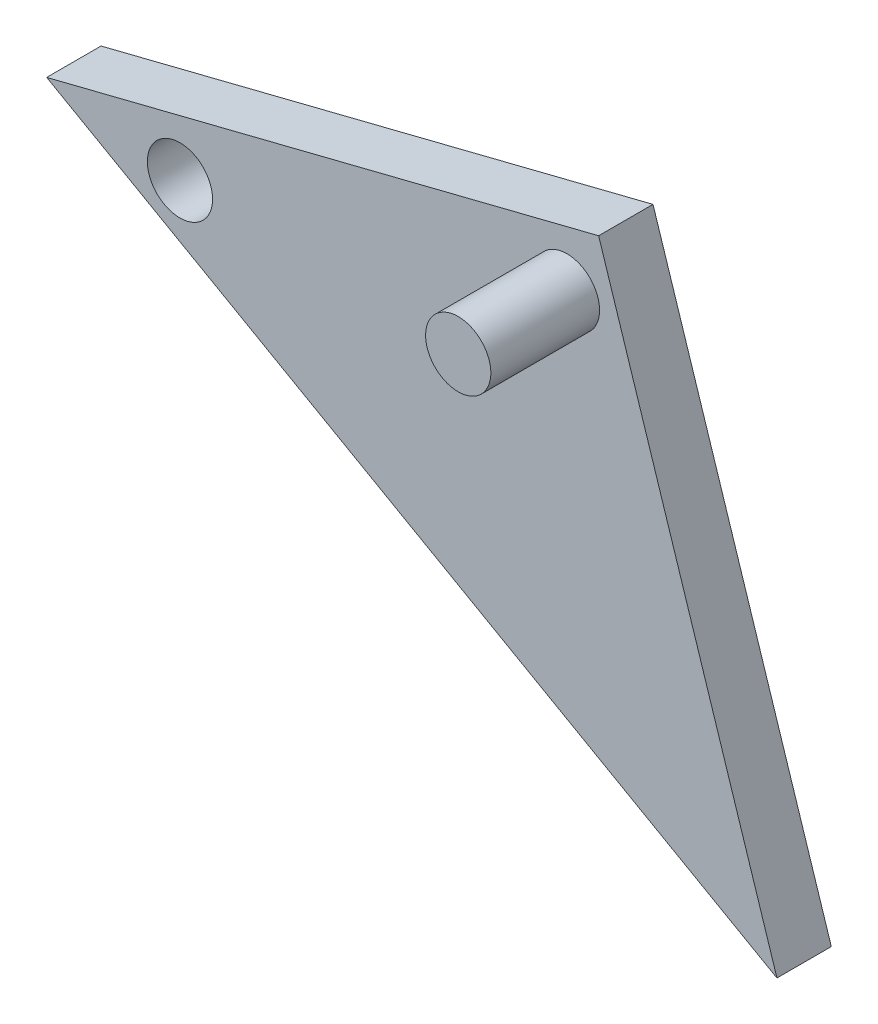
from build123d import *

# Parameters (mm, degrees)
SKETCH1_R           = 3
BOSS_EXTRUDE1_DEPTH = 5
SKETCH2_R           = 3
BOSS_EXTRUDE2_DEPTH = 15


with BuildPart() as part:
    # Sketch1 → Boss-Extrude1 (new body)
    with BuildSketch(Plane.XY):
        Polygon((-12.258432753, 2.072266385), (38.505942563, 14.841548426), (54.906660914, -36.079753149), align=None)
        Circle(SKETCH1_R, mode=Mode.SUBTRACT)
        with Locations((35.591293936, 8.952641841)):
            Circle(SKETCH1_R, mode=Mode.SUBTRACT)
    extrude(amount=BOSS_EXTRUDE1_DEPTH)

    # Sketch2 → Boss-Extrude2 (add)
    with BuildSketch(Plane(origin=(0, 0, 0), x_dir=(-1, 0, 0), z_dir=(0, 0, -1))):
        with Locations((-35.591293936, 8.952641841)):
            Circle(SKETCH2_R)
    extrude(amount=-BOSS_EXTRUDE2_DEPTH)


solid = part.part
